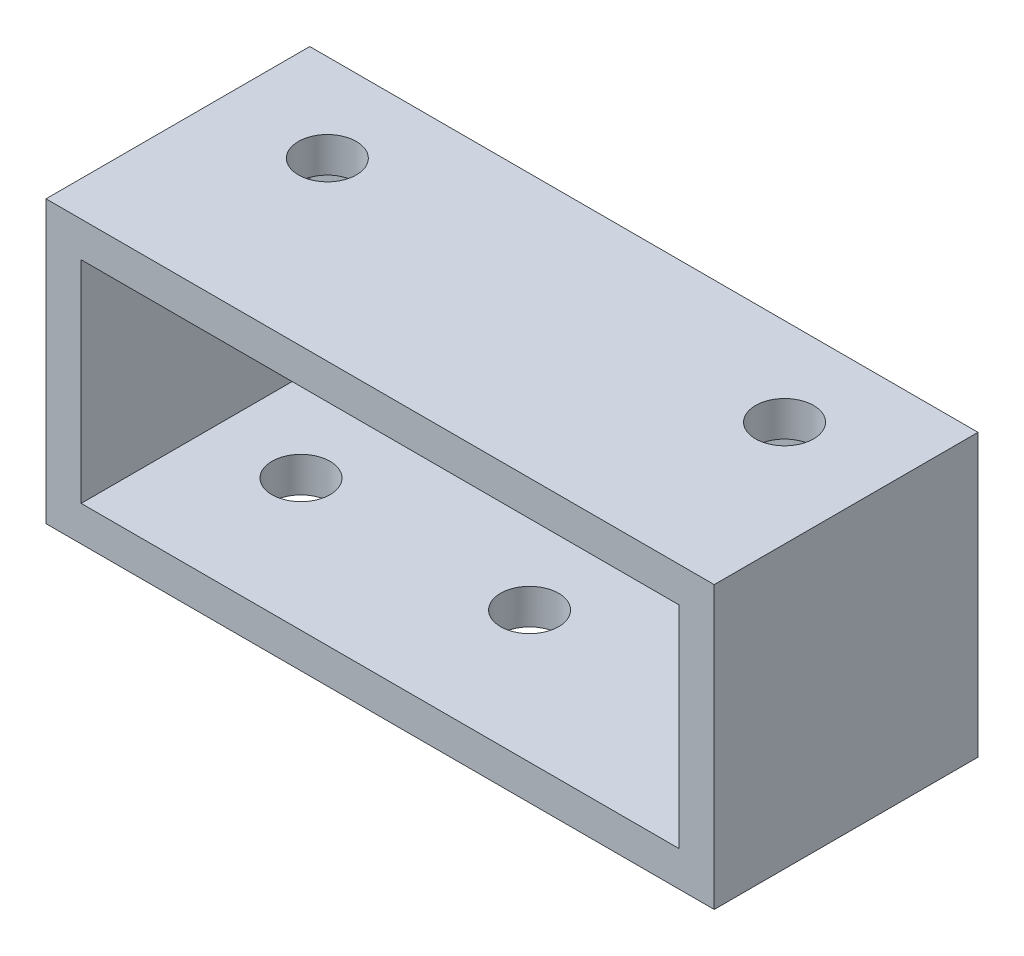
from build123d import *

# Parameters (mm, degrees)
SKETCH_1_W          = 38
SKETCH_1_H          = 15
EXTRUDE_1_DEPTH     = 16
SKETCH_2_W          = 34
SKETCH_2_H          = 12
CUT_EXTRUDE_1_DEPTH = 13
SKETCH_3_R          = 1.65
CUT_EXTRUDE_2_DEPTH = 2
SKETCH_4_R          = 1.65
CUT_EXTRUDE_3_DEPTH = 10


with BuildPart() as part:
    # 草图1 → 凸台-拉伸1 (new body)
    with BuildSketch(Plane(origin=(0, 0, 0), x_dir=(1, 0, 0), z_dir=(0, 1, 0))):
        with Locations((19, 7.5)):
            Rectangle(SKETCH_1_W, SKETCH_1_H)
    extrude(amount=EXTRUDE_1_DEPTH)

    # 草图2 → 切除-拉伸1 (cut)
    with BuildSketch(Plane.XY):
        with Locations((19, 8)):
            Rectangle(SKETCH_2_W, SKETCH_2_H)
    extrude(amount=-CUT_EXTRUDE_1_DEPTH, mode=Mode.SUBTRACT)

    # 草图3 → 切除-拉伸2 (cut)
    with BuildSketch(Plane(origin=(0, 16, 0), x_dir=(1, 0, 0), z_dir=(0, 1, 0))):
        with Locations(Location((6, 10, 0), (0, 0, 270))):
            Circle(SKETCH_3_R)
        with Locations(Location((32, 10, 0), (0, 0, 90))):
            Circle(SKETCH_3_R)
    extrude(amount=-CUT_EXTRUDE_2_DEPTH, mode=Mode.SUBTRACT)

    # 草图4 → 切除-拉伸3 (cut)
    with BuildSketch(Plane(origin=(0, 2, 0), x_dir=(1, 0, 0), z_dir=(0, 1, 0))):
        with Locations(Location((7, 7.5, 0), (0, 0, 270))):
            Circle(SKETCH_4_R)
        with Locations(Location((20, 7.5, 0), (0, 0, 270))):
            Circle(SKETCH_4_R)
    extrude(amount=-CUT_EXTRUDE_3_DEPTH, mode=Mode.SUBTRACT)


solid = part.part
